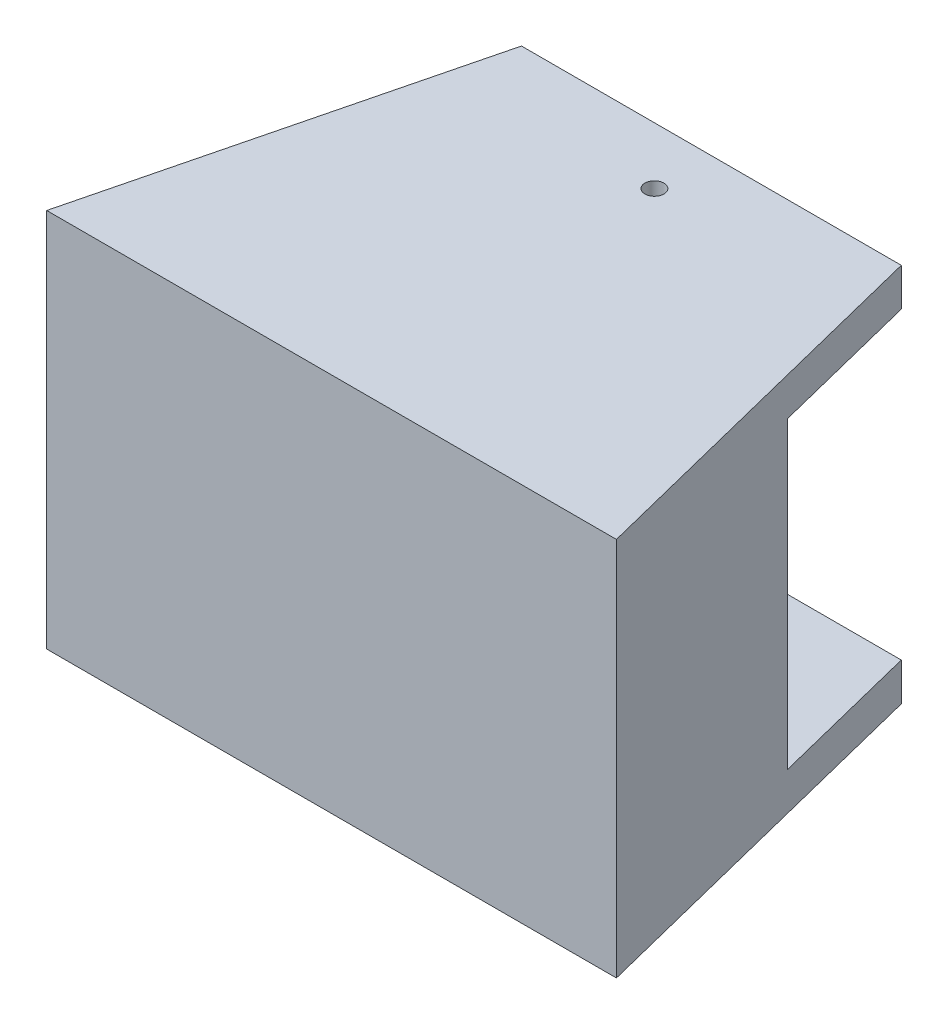
from build123d import *

# Parameters (mm, degrees)
EXTRUDE_1_DEPTH          = 100
CUT_EXTRUDE_2_DEPTH      = 174.205080757
CUT_EXTRUDE_2_DEPTH_BACK = 174.205080757
SKETCH_2_W               = 40
SKETCH_2_H               = 80
CUT_EXTRUDE_3_DEPTH      = 174.205080757
CUT_EXTRUDE_3_DEPTH_BACK = 174.205080757
SKETCH_3_R               = 2.5
CUT_EXTRUDE_4_DEPTH      = 174.205080757


with BuildPart() as part:
    # 草图1 → 凸台-拉伸1 (new body)
    with BuildSketch(Plane(origin=(0, 0, 0), x_dir=(1, 0, 0), z_dir=(0, 1, 0))):
        Polygon((-50, 100), (50, 100), (100, -100), (-100, -100), align=None)
    extrude(amount=EXTRUDE_1_DEPTH)

    # 草图2 → 切除-拉伸2 (cut, two sides: drawn at the far end of the back side and taken through both)
    with BuildSketch(Plane(origin=(0, 0, 0), x_dir=(0, 0, -1), z_dir=(1, 0, 0)).offset(-CUT_EXTRUDE_2_DEPTH_BACK)):
        with Locations((80, 50)):
            Rectangle(SKETCH_2_W, SKETCH_2_H)
    extrude(amount=CUT_EXTRUDE_2_DEPTH + CUT_EXTRUDE_2_DEPTH_BACK, mode=Mode.SUBTRACT)

    # 草图3 → 切除-拉伸3 (cut, two sides: drawn at the far end of the back side and taken through both)
    with BuildSketch(Plane(origin=(0, 100, 0), x_dir=(1, 0, 0), z_dir=(0, 1, 0)).offset(-CUT_EXTRUDE_3_DEPTH_BACK)):
        with Locations(Location((0, 85, 0), (0, 0, 270))):
            Circle(SKETCH_3_R)
    extrude(amount=CUT_EXTRUDE_3_DEPTH + CUT_EXTRUDE_3_DEPTH_BACK, mode=Mode.SUBTRACT)

    # 草图4 → 切除-拉伸4 (cut, through all)
    with BuildSketch(Plane(origin=(0, 100, 0), x_dir=(1, 0, 0), z_dir=(0, 1, 0))):
        Polygon((-75, 0), (75, 0), (100, -100), (-100, -100), align=None)
    extrude(amount=-CUT_EXTRUDE_4_DEPTH, mode=Mode.SUBTRACT)


solid = part.part
